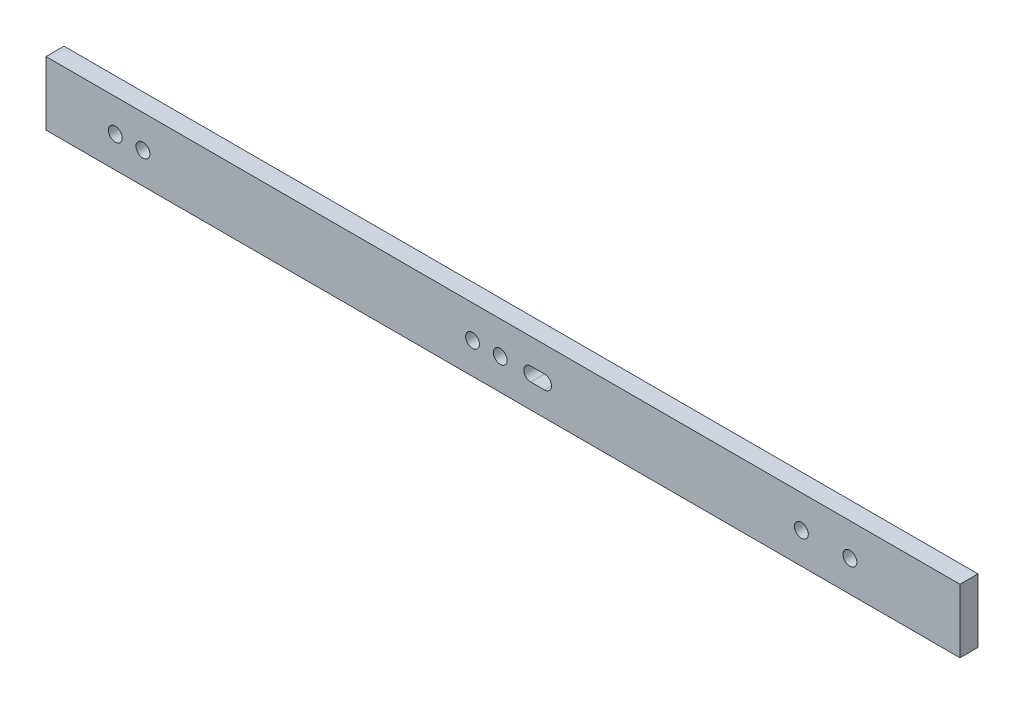
from build123d import *

# Parameters (mm, degrees)
SKETCH_1_W      = 330
SKETCH_1_H      = 23
SKETCH_1_R      = 2.5
EXTRUDE_1_DEPTH = 6.5


with BuildPart() as part:
    # Эскиз1 → Бобышка-Вытянуть1 (new body)
    with BuildSketch(Plane.XY.offset(6.5)):
        with Locations((165, 11.5)):
            Rectangle(SKETCH_1_W, SKETCH_1_H)
        with Locations(Location((35, 11.25, 0), (0, 0, 180))):
            Circle(SKETCH_1_R, mode=Mode.SUBTRACT)
        with Locations(Location((25, 11.25, 0), (0, 0, 180))):
            Circle(SKETCH_1_R, mode=Mode.SUBTRACT)
        with Locations(Location((164, 11.25, 0), (0, 0, 180))):
            Circle(SKETCH_1_R, mode=Mode.SUBTRACT)
        with Locations(Location((154, 11.25, 0), (0, 0, 180))):
            Circle(SKETCH_1_R, mode=Mode.SUBTRACT)
        with Locations(Location((272.722137, 11.25, 0), (0, 0, 180))):
            Circle(SKETCH_1_R, mode=Mode.SUBTRACT)
        with Locations(Location((290.250244, 11.25, 0), (0, 0, 180))):
            Circle(SKETCH_1_R, mode=Mode.SUBTRACT)
        with BuildLine():
            Line((180, 8.75), (175, 8.75))
            ThreePointArc((175, 8.75), (172.5, 11.25), (175, 13.75))
            Line((175, 13.75), (180, 13.75))
            ThreePointArc((180, 13.75), (182.5, 11.25), (180, 8.75))
        make_face(mode=Mode.SUBTRACT)
    extrude(amount=-EXTRUDE_1_DEPTH)


solid = part.part
